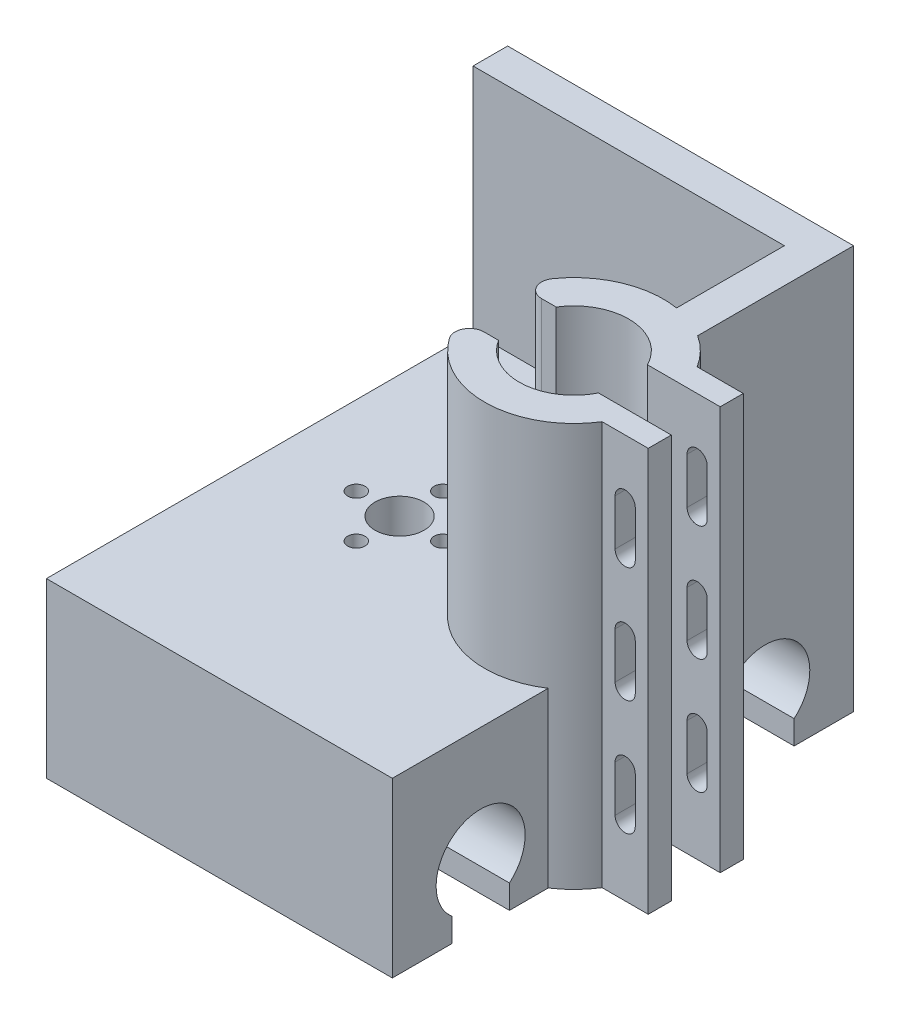
from build123d import *
from build123d.topology import SkipClean

# Parameters (mm, degrees)
MAIN_BASE_DEPTH                 = 60
HOLES_SKETCH_R                  = 4.25
HOLES_SKETCH_R_2                = 1.5
HOLES_SKETCH_R_3                = 9.5
HOLES_DEPTH                     = 30
BOSS_EXTRUDE3_START             = 40
BOSS_EXTRUDE3_DEPTH             = 40
BOSS_EXTRUDE4_REACH             = 84.462
BOSS_EXTRUDE4_DIRECTION_2_REACH = 84.462
CUT_EXTRUDE2_START              = -20
SKETCH4_R                       = 4.25
SKETCH4_R_2                     = 1.5
CUT_EXTRUDE2_DEPTH              = 20
CUT_EXTRUDE3_REACH              = 107.839


with BuildPart() as part:
    # Sketch1 → Main Base (new body)
    with BuildSketch(Plane(origin=(0, 0, 0), x_dir=(0, 0, -1), z_dir=(1, 0, 0))):
        with BuildLine():
            Line((-40, 20), (40, 20))
            Line((40, 20), (40, -10))
            Line((40, -10), (29.69, -10))
            Line((29.69, -10), (29.69, -5.882040462))
            ThreePointArc((29.69, -5.882040462), (24.69, 7.72), (19.69, -5.882040462))
            Line((19.69, -5.882040462), (19.69, -10))
            Line((19.69, -10), (-19.69, -10))
            Line((-19.69, -10), (-19.69, -5.882040462))
            ThreePointArc((-19.69, -5.882040462), (-24.69, 7.72), (-29.69, -5.882040462))
            Line((-29.69, -5.882040462), (-29.69, -10))
            Line((-29.69, -10), (-40, -10))
            Line((-40, -10), (-40, 20))
        make_face()
    extrude(amount=MAIN_BASE_DEPTH)

    # Holes_Sketch → Holes (cut)
    with BuildSketch(Plane(origin=(0, 20, 0), x_dir=(1, 0, 0), z_dir=(0, 1, 0))):
        with Locations(Location((21.25, 0, 0), (0, 0, 270))):
            Circle(HOLES_SKETCH_R)
        with Locations(Location((21.25, -7.5, 0), (0, 0, 270))):
            Circle(HOLES_SKETCH_R_2)
        with Locations(Location((13.75, 0, 0), (0, 0, 270))):
            Circle(HOLES_SKETCH_R_2)
        with Locations(Location((28.75, 0, 0), (0, 0, 270))):
            Circle(HOLES_SKETCH_R_2)
        with Locations(Location((21.25, 7.5, 0), (0, 0, 270))):
            Circle(HOLES_SKETCH_R_2)
        with Locations((51.5, 0)):
            Circle(HOLES_SKETCH_R_3)
    extrude(amount=-HOLES_DEPTH, mode=Mode.SUBTRACT)

    # Sketch3 → Boss-Extrude3 (add)
    with SkipClean():  # the faces are left unmerged after this step: merging them gives an invalid solid
        with BuildSketch(Plane(origin=(0, 20, 0), x_dir=(1, 0, 0), z_dir=(0, 1, 0)).offset(BOSS_EXTRUDE3_START)):
            with BuildLine():
                ThreePointArc((38.839623499, -8.942307692), (48.607661418, -15.227750245), (60, -12.961481397))
                Line((60, -12.961481397), (60, -7.5))
                Line((60, -7.5), (60, -4.242640687))
                ThreePointArc((60, -4.242640687), (51.933558112, -9.490101547), (43.422252789, -5))
                Line((43.422252789, -5), (40.881619709, -5))
                ThreePointArc((40.881619709, -5), (38.66173579, -6.350167236), (38.839623499, -8.942307692))
            make_face()
            with BuildLine():
                ThreePointArc((60, 12.961481397), (57.122608838, 14.444246946), (54, 15.297058541))
                ThreePointArc((54, 15.297058541), (45.508003067, 14.294963195), (38.839623499, 8.942307692))
                ThreePointArc((38.839623499, 8.942307692), (38.66173579, 6.350167236), (40.881619709, 5))
                Line((40.881619709, 5), (43.422252789, 5))
                ThreePointArc((43.422252789, 5), (51.933558112, 9.490101547), (60, 4.242640687))
                Line((60, 4.242640687), (60, 7.5))
                Line((60, 7.5), (60, 12.961481397))
            make_face()
            with BuildLine():
                Line((60, 34), (54, 34))
                Line((54, 34), (54, 15.297058541))
                ThreePointArc((54, 15.297058541), (57.122608838, 14.444246946), (60, 12.961481397))
                Line((60, 12.961481397), (60, 34))
            make_face()
            Polygon((0, 40), (0, 34), (54, 34), (60, 34), (60, 40), align=None)
        extrude(amount=-BOSS_EXTRUDE3_DEPTH)

    # Boss-Extrude4: up to this face of the body (flat: up to its plane)
    boss_extrude4_end = Plane(part.part.faces().sort_by_distance((49.565869061, 60, 10.678132871))[0])
    # Sketch3<6> → Boss-Extrude4 (add, up to the picked face)
    with BuildSketch(Plane(origin=(0, 20, 0), x_dir=(1, 0, 0), z_dir=(0, 1, 0)), mode=Mode.PRIVATE) as boss_extrude4_sk1:
        with BuildLine():
            Line((60, -7.5), (60, -12.961481397))
            ThreePointArc((60, -12.961481397), (62.567738473, -10.8515052), (64.626647497, -8.242640687))
            Line((64.626647497, -8.242640687), (72.626647497, -8.242640687))
            Line((72.626647497, -8.242640687), (72.626647497, -4.242640687))
            Line((72.626647497, -4.242640687), (60, -4.242640687))
            Line((60, -4.242640687), (60, -7.5))
        make_face()
    boss_extrude4_tool1 = split(extrude(boss_extrude4_sk1.sketch, amount=BOSS_EXTRUDE4_REACH, mode=Mode.PRIVATE), bisect_by=boss_extrude4_end, keep=Keep.BOTH, mode=Mode.PRIVATE)
    # Sketch3<6> → Boss-Extrude4 (add, up to the picked face)
    with BuildSketch(Plane(origin=(0, 20, 0), x_dir=(1, 0, 0), z_dir=(0, 1, 0)), mode=Mode.PRIVATE) as boss_extrude4_sk2:
        with BuildLine():
            ThreePointArc((64.626647497, 8.242640687), (62.567738473, 10.8515052), (60, 12.961481397))
            Line((60, 12.961481397), (60, 7.5))
            Line((60, 7.5), (60, 4.242640687))
            Line((60, 4.242640687), (72.626647497, 4.242640687))
            Line((72.626647497, 4.242640687), (72.626647497, 8.242640687))
            Line((72.626647497, 8.242640687), (64.626647497, 8.242640687))
        make_face()
    boss_extrude4_tool2 = split(extrude(boss_extrude4_sk2.sketch, amount=BOSS_EXTRUDE4_REACH, mode=Mode.PRIVATE), bisect_by=boss_extrude4_end, keep=Keep.BOTH, mode=Mode.PRIVATE)
    add(boss_extrude4_tool1.solids().sort_by(Axis((65.389209, 20, 6.97315), (0, 1, 0)))[0])
    add(boss_extrude4_tool2.solids().sort_by(Axis((65.389209, 20, -6.97315), (0, 1, 0)))[0])

    # Boss-Extrude4 direction 2: up to this face of the body (flat: up to its plane)
    boss_extrude4_direction_2_end = Plane(part.part.faces().sort_by_distance((0.717689654, -10, 0))[0])
    # Sketch3<6> → Boss-Extrude4 direction 2 (add, up to the picked face)
    with BuildSketch(Plane(origin=(0, 20, 0), x_dir=(1, 0, 0), z_dir=(0, 1, 0)), mode=Mode.PRIVATE) as boss_extrude4_direction_2_sk1:
        with BuildLine():
            Line((60, -7.5), (60, -12.961481397))
            ThreePointArc((60, -12.961481397), (62.567738473, -10.8515052), (64.626647497, -8.242640687))
            Line((64.626647497, -8.242640687), (72.626647497, -8.242640687))
            Line((72.626647497, -8.242640687), (72.626647497, -4.242640687))
            Line((72.626647497, -4.242640687), (60, -4.242640687))
            Line((60, -4.242640687), (60, -7.5))
        make_face()
    boss_extrude4_direction_2_tool1 = split(extrude(boss_extrude4_direction_2_sk1.sketch, amount=-BOSS_EXTRUDE4_DIRECTION_2_REACH, mode=Mode.PRIVATE), bisect_by=boss_extrude4_direction_2_end, keep=Keep.BOTH, mode=Mode.PRIVATE)
    # Sketch3<6> → Boss-Extrude4 direction 2 (add, up to the picked face)
    with BuildSketch(Plane(origin=(0, 20, 0), x_dir=(1, 0, 0), z_dir=(0, 1, 0)), mode=Mode.PRIVATE) as boss_extrude4_direction_2_sk2:
        with BuildLine():
            ThreePointArc((64.626647497, 8.242640687), (62.567738473, 10.8515052), (60, 12.961481397))
            Line((60, 12.961481397), (60, 7.5))
            Line((60, 7.5), (60, 4.242640687))
            Line((60, 4.242640687), (72.626647497, 4.242640687))
            Line((72.626647497, 4.242640687), (72.626647497, 8.242640687))
            Line((72.626647497, 8.242640687), (64.626647497, 8.242640687))
        make_face()
    boss_extrude4_direction_2_tool2 = split(extrude(boss_extrude4_direction_2_sk2.sketch, amount=-BOSS_EXTRUDE4_DIRECTION_2_REACH, mode=Mode.PRIVATE), bisect_by=boss_extrude4_direction_2_end, keep=Keep.BOTH, mode=Mode.PRIVATE)
    add(boss_extrude4_direction_2_tool1.solids().sort_by(Axis((65.389209, 20, 6.97315), (0, -1, 0)))[0])
    add(boss_extrude4_direction_2_tool2.solids().sort_by(Axis((65.389209, 20, -6.97315), (0, -1, 0)))[0])

    # Sketch4 → Cut-Extrude2 (cut)
    # profile 1 of 5: a face of its own
    with SkipClean():  # the faces are left unmerged after this step: merging them gives an invalid solid
        with BuildSketch(Plane.XZ.offset(10).offset(CUT_EXTRUDE2_START)):
            with Locations(Location((21.25, 0, 0), (0, 0, 90))):
                Circle(SKETCH4_R)
        # profile 2 of 5: a face of its own
        with BuildSketch(Plane.XZ.offset(10).offset(CUT_EXTRUDE2_START)):
            Polygon((31.65, 1.674315781), (28.75, 3.348631561), (25.85, 1.674315781), (25.85, -1.674315781), (28.75, -3.348631561), (31.65, -1.674315781), align=None)
            with Locations(Location((28.75, 0, 0), (0, 0, 90))):
                Circle(SKETCH4_R_2, mode=Mode.SUBTRACT)
        # profile 3 of 5: a face of its own
        with BuildSketch(Plane.XZ.offset(10).offset(CUT_EXTRUDE2_START)):
            Polygon((22.924315781, 4.6), (24.598631561, 7.5), (22.924315781, 10.4), (19.575684219, 10.4), (17.901368439, 7.5), (19.575684219, 4.6), align=None)
            with Locations(Location((21.25, 7.5, 0), (0, 0, 90))):
                Circle(SKETCH4_R_2, mode=Mode.SUBTRACT)
        # profile 4 of 5: a face of its own
        with BuildSketch(Plane.XZ.offset(10).offset(CUT_EXTRUDE2_START)):
            Polygon((22.924315781, -10.4), (24.598631561, -7.5), (22.924315781, -4.6), (19.575684219, -4.6), (17.901368439, -7.5), (19.575684219, -10.4), align=None)
            with Locations(Location((21.25, -7.5, 0), (0, 0, 90))):
                Circle(SKETCH4_R_2, mode=Mode.SUBTRACT)
        # profile 5 of 5: a face of its own
        with BuildSketch(Plane.XZ.offset(10).offset(CUT_EXTRUDE2_START)):
            Polygon((10.85, -1.674315781), (13.75, -3.348631561), (16.65, -1.674315781), (16.65, 1.674315781), (13.75, 3.348631561), (10.85, 1.674315781), align=None)
            with Locations(Location((13.75, 0, 0), (0, 0, 90))):
                Circle(SKETCH4_R_2, mode=Mode.SUBTRACT)
        extrude(amount=CUT_EXTRUDE2_DEPTH, mode=Mode.SUBTRACT)

    # Cut-Extrude3: up to this face of the body (flat: up to its plane)
    cut_extrude3_end = Plane(part.part.faces().sort_by_distance((68.626647497, 40, 8.242640687))[0])
    # Sketch7 → Cut-Extrude3 (cut, up to the picked face)
    with BuildSketch(Plane(origin=(0, 0, -8.242640687), x_dir=(-1, 0, 0), z_dir=(0, 0, -1)), mode=Mode.PRIVATE) as cut_extrude3_sk1:
        with BuildLine():
            Line((-66.876647497, 50), (-66.876647497, 42))
            ThreePointArc((-66.876647497, 42), (-68.626647497, 40.25), (-70.376647497, 42))
            Line((-70.376647497, 42), (-70.376647497, 50))
            ThreePointArc((-70.376647497, 50), (-68.626647497, 51.75), (-66.876647497, 50))
        make_face()
    cut_extrude3_tool1 = split(extrude(cut_extrude3_sk1.sketch, amount=-CUT_EXTRUDE3_REACH, mode=Mode.PRIVATE), bisect_by=cut_extrude3_end, keep=Keep.BOTH, mode=Mode.PRIVATE)
    # Sketch7 → Cut-Extrude3 (cut, up to the picked face)
    with BuildSketch(Plane(origin=(0, 0, -8.242640687), x_dir=(-1, 0, 0), z_dir=(0, 0, -1)), mode=Mode.PRIVATE) as cut_extrude3_sk2:
        with BuildLine():
            Line((-66.876647497, 30), (-66.876647497, 22))
            ThreePointArc((-66.876647497, 22), (-68.626647497, 20.25), (-70.376647497, 22))
            Line((-70.376647497, 22), (-70.376647497, 30))
            ThreePointArc((-70.376647497, 30), (-68.626647497, 31.75), (-66.876647497, 30))
        make_face()
    cut_extrude3_tool2 = split(extrude(cut_extrude3_sk2.sketch, amount=-CUT_EXTRUDE3_REACH, mode=Mode.PRIVATE), bisect_by=cut_extrude3_end, keep=Keep.BOTH, mode=Mode.PRIVATE)
    # Sketch7 → Cut-Extrude3 (cut, up to the picked face)
    with BuildSketch(Plane(origin=(0, 0, -8.242640687), x_dir=(-1, 0, 0), z_dir=(0, 0, -1)), mode=Mode.PRIVATE) as cut_extrude3_sk3:
        with BuildLine():
            Line((-66.876647497, 10), (-66.876647497, 2))
            ThreePointArc((-66.876647497, 2), (-68.626647497, 0.25), (-70.376647497, 2))
            Line((-70.376647497, 2), (-70.376647497, 10))
            ThreePointArc((-70.376647497, 10), (-68.626647497, 11.75), (-66.876647497, 10))
        make_face()
    cut_extrude3_tool3 = split(extrude(cut_extrude3_sk3.sketch, amount=-CUT_EXTRUDE3_REACH, mode=Mode.PRIVATE), bisect_by=cut_extrude3_end, keep=Keep.BOTH, mode=Mode.PRIVATE)
    add(cut_extrude3_tool1.solids().sort_by(Axis((68.626647, 46, -8.242641), (0, 0, 1)))[0], mode=Mode.SUBTRACT)
    add(cut_extrude3_tool2.solids().sort_by(Axis((68.626647, 26, -8.242641), (0, 0, 1)))[0], mode=Mode.SUBTRACT)
    add(cut_extrude3_tool3.solids().sort_by(Axis((68.626647, 6, -8.242641), (0, 0, 1)))[0], mode=Mode.SUBTRACT)


solid = part.part
